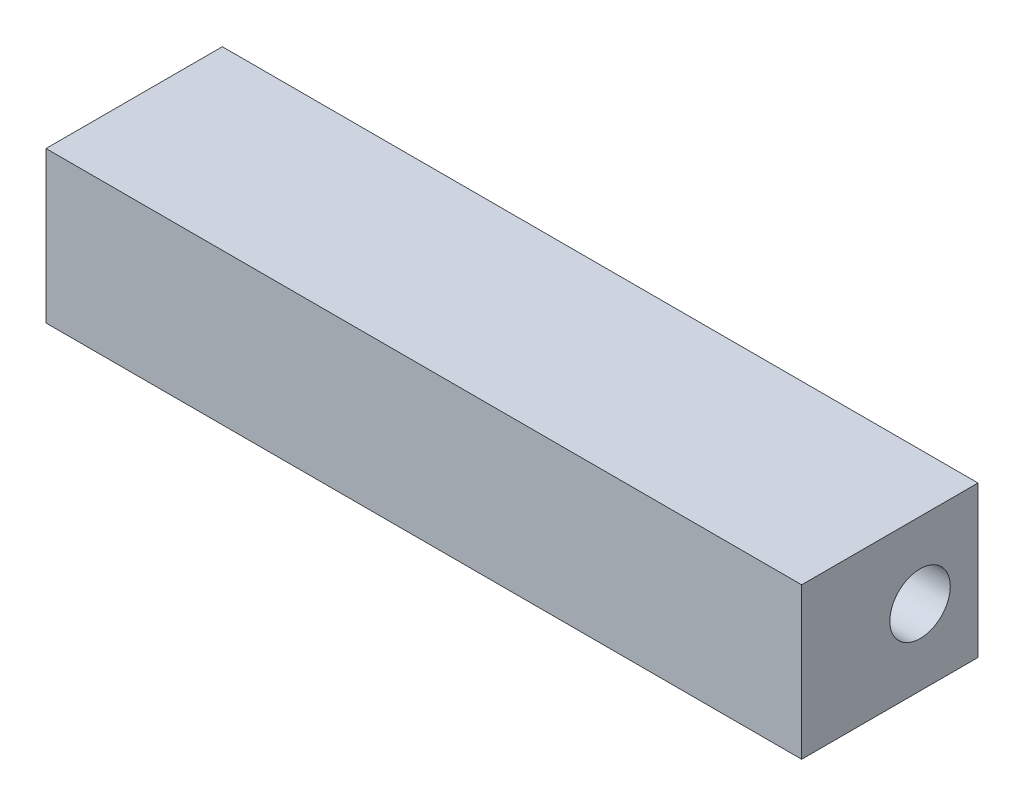
from build123d import *

# Parameters (mm, degrees)
SKETCH_1_W          = 150
SKETCH_1_H          = 35
EXTRUDE_1_DEPTH     = 30
SKETCH_2_R          = 6
CUT_EXTRUDE_3_DEPTH = 20
SKETCH_3_W          = 80
SKETCH_3_H          = 25
CUT_EXTRUDE_2_DEPTH = 15
SKETCH_5_R          = 10
CUT_EXTRUDE_6_DEPTH = 95
SKETCH_6_R          = 6
CUT_EXTRUDE_7_DEPTH = 25


with BuildPart() as part:
    # Эскиз1 → Бобышка-Вытянуть1 (new body)
    with BuildSketch(Plane(origin=(0, 0, 0), x_dir=(1, 0, 0), z_dir=(0, 1, 0))):
        with Locations((24.604604994, 5.307565724)):
            Rectangle(SKETCH_1_W, SKETCH_1_H)
    extrude(amount=EXTRUDE_1_DEPTH)

    # Эскиз2 → Вырез-Вытянуть3 (cut)
    with BuildSketch(Plane(origin=(99.604604994, 0, 0), x_dir=(0, 0, -1), z_dir=(1, 0, 0))):
        with Locations((11.307565724, 15)):
            Circle(SKETCH_2_R)
    extrude(amount=-CUT_EXTRUDE_3_DEPTH, mode=Mode.SUBTRACT)

    # Эскиз3 → Вырез-Вытянуть2 (cut)
    with BuildSketch(Plane(origin=(0, 0, -22.807565724), x_dir=(-1, 0, 0), z_dir=(0, 0, -1))):
        with Locations((-24.604604994, 12.5)):
            Rectangle(SKETCH_3_W, SKETCH_3_H)
    extrude(amount=-CUT_EXTRUDE_2_DEPTH, mode=Mode.SUBTRACT)

    # Эскиз5 → Вырез-Вытянуть6 (cut)
    with BuildSketch(Plane(origin=(79.604604994, 0, 0), x_dir=(0, 0, -1), z_dir=(1, 0, 0))):
        with Locations((11.307565724, 15)):
            Circle(SKETCH_5_R)
    extrude(amount=-CUT_EXTRUDE_6_DEPTH, mode=Mode.SUBTRACT)

    # Эскиз6 → Вырез-Вытянуть7 (cut)
    with BuildSketch(Plane(origin=(-15.395395006, 0, 0), x_dir=(0, 0, -1), z_dir=(1, 0, 0))):
        with Locations((11.307565724, 15)):
            Circle(SKETCH_6_R)
    extrude(amount=-CUT_EXTRUDE_7_DEPTH, mode=Mode.SUBTRACT)


solid = part.part
